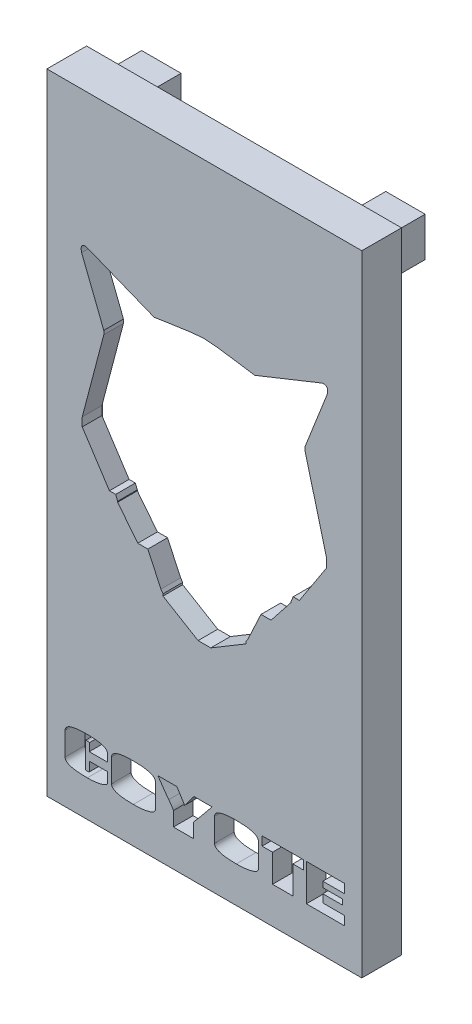
from build123d import *

# Parameters (mm, degrees)
SKETCH1_W               = 50.8
SKETCH1_H               = 89.81384407
SKETCH1_H_2             = 5.893077965
BOSS_EXTRUDE1_DEPTH     = 3.175
CUT_EXTRUDE3_DEPTH      = 114.636616568
CUT_EXTRUDE3_DEPTH_BACK = 114.636616568
SKETCH14_W              = 6.35
SKETCH14_H              = 6.35
BOSS_EXTRUDE2_DEPTH     = 9.5758
CUT_EXTRUDE4_DEPTH      = 115.305655727
SKETCH16_W              = 2.715191334
SKETCH16_H              = 5.015118111
SKETCH16_W_2            = 2.363813632
CUT_EXTRUDE5_DEPTH      = 115.305655727
SKETCH17_W              = 1.689278773
SKETCH17_H              = 0.508
CUT_EXTRUDE6_DEPTH      = 115.305655727
SKETCH18_W              = 2.847153835
SKETCH18_H              = 0.508
SKETCH18_W_2            = 2.886155942
CUT_EXTRUDE10_DEPTH     = 115.305655727
SKETCH20_W              = 0.635
SKETCH20_H              = 0.896075863
SKETCH20_H_2            = 1.286096937
BOSS_EXTRUDE3_DEPTH     = 3.175
SKETCH22_W              = 50.8
SKETCH22_H              = 101.6
SKETCH22_W_2            = 45.72
SKETCH22_H_2            = 96.52
BOSS_EXTRUDE4_DEPTH     = 3.2258


with BuildPart() as part:
    # Sketch1 → Boss-Extrude1 (new body)
    with BuildSketch(Plane.XY):
        with Locations((25.4, 56.693077965)):
            Rectangle(SKETCH1_W, SKETCH1_H)
        with Locations((25.4, 8.839616948)):
            Rectangle(SKETCH1_W, SKETCH1_H_2)
        with Locations((25.4, 2.946538983)):
            Rectangle(SKETCH1_W, SKETCH1_H_2)
    extrude(amount=BOSS_EXTRUDE1_DEPTH)

    # Sketch12 (on Front Plane) → Cut-Extrude3 (cut, two sides: drawn at the far end of the back side and taken through both)
    # profile 1 of 5: a face of its own
    with BuildSketch(Plane.XY.offset(-CUT_EXTRUDE3_DEPTH_BACK)):
        with BuildLine():
            Line((33.533180617, 75.557638808), (44.372260801, 79.896871905))
            add(Edge.make_bspline(
                [(44.372260801, 79.896871905), (45.54754183, 80.104772664), (45.218073682, 78.730973984)],
                knots=[0, 0, 0, 1, 1, 1], degree=2))
            Line((45.218073682, 78.730973984), (41.716677108, 69.854933669))
            Line((41.716677108, 69.854933669), (41.641299392, 69.66385116))
            Line((41.641299392, 69.66385116), (41.641299392, 69.05068653))
            Line((41.641299392, 69.05068653), (45.115249103, 55.842134688))
            Line((45.115249103, 55.842134688), (45.115249103, 54.43891912))
            Line((45.115249103, 54.43891912), (40.729741051, 47.713147015))
            Line((40.729741051, 47.713147015), (39.719862908, 47.713147015))
            Line((39.719862908, 47.713147015), (39.405036562, 46.915062228))
            Line((39.405036562, 46.915062228), (39.405036562, 46.775055961))
            Line((39.405036562, 46.775055961), (36.162162693, 42.66577193))
            Line((36.162162693, 42.66577193), (34.536169198, 42.66577193))
            Line((34.536169198, 42.66577193), (32.418372749, 38.123007656))
            Line((32.418372749, 38.123007656), (32.088635521, 37.637561181))
            Line((32.088635521, 37.637561181), (32.088635521, 37.316983321))
            Line((32.088635521, 37.316983321), (26.432800331, 33.932661708))
            Line((26.432800331, 33.932661708), (24.384837091, 33.932661708))
            Line((24.384837091, 33.932661708), (18.729001901, 37.316983321))
            Line((18.729001901, 37.316983321), (18.729001901, 37.637561181))
            Line((18.729001901, 37.637561181), (18.399264673, 38.123007656))
            Line((18.399264673, 38.123007656), (16.281468224, 42.66577193))
            Line((16.281468224, 42.66577193), (14.655474729, 42.66577193))
            Line((14.655474729, 42.66577193), (11.412600859, 46.775055961))
            Line((11.412600859, 46.775055961), (11.412600859, 46.915062228))
            Line((11.412600859, 46.915062228), (11.097774513, 47.713147015))
            Line((11.097774513, 47.713147015), (10.087896371, 47.713147015))
            Line((10.087896371, 47.713147015), (5.702388318, 54.43891912))
            Line((5.702388318, 54.43891912), (5.702388318, 55.842134688))
            Line((5.702388318, 55.842134688), (9.176338029, 69.05068653))
            Line((9.176338029, 69.05068653), (9.176338029, 69.66385116))
            Line((9.176338029, 69.66385116), (9.100960314, 69.854933669))
            Line((9.100960314, 69.854933669), (5.59956374, 78.730973984))
            add(Edge.make_bspline(
                [(6.445376621, 79.896871905), (5.270095592, 80.104772664), (5.59956374, 78.730973984)],
                knots=[0, 0, 0, 1, 1, 1], degree=2))
            Line((6.445376621, 79.896871905), (17.284456805, 75.557638808))
            add(Edge.make_bspline(
                [(25.408818711, 76.605167447), (22.679673175, 76.517954783), (19.915041946, 75.880309853), (17.284456805, 75.557638808)],
                knots=[0, 0, 0, 0, 1, 1, 1, 1], degree=3))
            add(Edge.make_bspline(
                [(25.408818711, 76.605167447), (28.137964246, 76.517954783), (30.902595475, 75.880309853), (33.533180617, 75.557638808)],
                knots=[0, 0, 0, 0, 1, 1, 1, 1], degree=3))
        make_face()
        with BuildLine():
            Line((28.674531702, 41.349936831), (25.408818711, 42.59901464))
            Line((25.408818711, 42.59901464), (22.14310572, 41.349936831))
            Line((22.14310572, 41.349936831), (21.911080277, 41.066350178))
            Line((21.911080277, 41.066350178), (21.911080277, 40.396054453))
            Line((21.911080277, 40.396054453), (22.513291148, 39.514932902))
            Line((22.513291148, 39.514932902), (22.513291148, 39.068353305))
            Line((22.513291148, 39.068353305), (22.118792937, 39.068353305))
            Line((22.118792937, 39.068353305), (21.911080277, 39.238300027))
            Line((21.911080277, 39.238300027), (21.601713019, 39.238300027))
            Line((21.601713019, 39.238300027), (15.398199281, 52.752570223))
            add(Edge.make_bspline(
                [(15.398199281, 52.752570223), (14.798847293, 53.560396559), (14.590626702, 52.704268037)],
                knots=[0, 0, 0, 1, 1, 1], degree=2))
            Line((14.590626702, 52.704268037), (14.482598203, 51.438992129))
            Line((14.482598203, 51.438992129), (14.034454043, 48.828335407))
            Line((14.034454043, 48.828335407), (14.034454043, 47.713147015))
            add(Edge.make_bspline(
                [(14.034454043, 47.713147015), (14.046644342, 47.46394935), (13.826015308, 47.65023431)],
                knots=[0, 0, 0, 1, 1, 1], degree=2))
            Line((13.826015308, 47.65023431), (13.200935785, 48.507615583))
            Line((13.200935785, 48.507615583), (13.166920012, 48.605047384))
            Line((13.166920012, 48.605047384), (13.099780036, 48.797357255))
            Line((13.099780036, 48.797357255), (11.497674661, 52.493386308))
            Line((11.497674661, 52.493386308), (11.122822158, 53.567081005))
            Line((11.122822158, 53.567081005), (10.9629018, 53.983859421))
            add(Edge.make_bspline(
                [(10.9629018, 53.983859421), (10.734267163, 54.529065093), (10.267019676, 54.55723369), (10.087896371, 53.97682384)],
                knots=[0, 0, 0, 0, 1, 1, 1, 1], degree=3))
            Line((10.087896371, 53.97682384), (9.710568318, 52.872237566))
            Line((9.710568318, 52.872237566), (8.779217587, 54.791682953))
            Line((8.779217587, 54.791682953), (8.700410565, 54.954098434))
            Line((8.700410565, 54.954098434), (8.700410565, 55.307788118))
            Line((8.700410565, 55.307788118), (8.781738852, 55.491219615))
            Line((8.781738852, 55.491219615), (11.877219107, 66.434388967))
            add(Edge.make_bspline(
                [(12.215342826, 66.434388967), (12.017692244, 66.611397939), (11.951050555, 66.685328278), (11.877219107, 66.434388967)],
                knots=[0, 0, 0, 0, 1, 1, 1, 1], degree=3))
            Line((12.215342826, 66.434388967), (13.61010317, 65.261522314))
            add(Edge.make_bspline(
                [(14.271970921, 66.217724851), (14.521104542, 65.45128403), (14.161246687, 65.070199484), (13.61010317, 65.261522314)],
                knots=[0, 0, 0, 0, 1, 1, 1, 1], degree=3))
            Line((14.271970921, 66.217724851), (13.964893083, 67.045129025))
            Line((13.964893083, 67.045129025), (11.282421082, 74.272900807))
            add(Edge.make_bspline(
                [(11.63635836, 74.384670473), (10.943135836, 74.777551714), (10.959759807, 74.700617446), (11.282421082, 74.272900807)],
                knots=[0, 0, 0, 0, 1, 1, 1, 1], degree=3))
            Line((11.63635836, 74.384670473), (16.889532696, 72.465957861))
            add(Edge.make_bspline(
                [(17.988601085, 72.298303361), (17.390511138, 72.248503772), (16.889532696, 72.465957861)],
                knots=[0, 0, 0, 1, 1, 1], degree=2))
            add(Edge.make_bspline(
                [(25.408818711, 73.479704956), (22.679673175, 73.392492293), (20.619186226, 72.620974406), (17.988601085, 72.298303361)],
                knots=[0, 0, 0, 0, 1, 1, 1, 1], degree=3))
            add(Edge.make_bspline(
                [(25.408818711, 73.479704956), (28.137964246, 73.392492293), (30.198451195, 72.620974406), (32.829036337, 72.298303361)],
                knots=[0, 0, 0, 0, 1, 1, 1, 1], degree=3))
            add(Edge.make_bspline(
                [(32.829036337, 72.298303361), (33.427126284, 72.248503772), (33.928104726, 72.465957861)],
                knots=[0, 0, 0, 1, 1, 1], degree=2))
            Line((33.928104726, 72.465957861), (39.181279062, 74.384670473))
            add(Edge.make_bspline(
                [(39.181279062, 74.384670473), (39.874501586, 74.777551714), (39.857877615, 74.700617446), (39.53521634, 74.272900807)],
                knots=[0, 0, 0, 0, 1, 1, 1, 1], degree=3))
            Line((39.53521634, 74.272900807), (36.852744339, 67.045129025))
            Line((36.852744339, 67.045129025), (36.5456665, 66.217724851))
            add(Edge.make_bspline(
                [(36.5456665, 66.217724851), (36.29653288, 65.45128403), (36.656390734, 65.070199484), (37.207534252, 65.261522314)],
                knots=[0, 0, 0, 0, 1, 1, 1, 1], degree=3))
            Line((37.207534252, 65.261522314), (38.602294596, 66.434388967))
            add(Edge.make_bspline(
                [(38.602294596, 66.434388967), (38.799945178, 66.611397939), (38.866586866, 66.685328278), (38.940418315, 66.434388967)],
                knots=[0, 0, 0, 0, 1, 1, 1, 1], degree=3))
            Line((38.940418315, 66.434388967), (42.035898569, 55.491219615))
            Line((42.035898569, 55.491219615), (42.117226857, 55.307788118))
            Line((42.117226857, 55.307788118), (42.117226857, 54.954098434))
            Line((42.117226857, 54.954098434), (42.038419834, 54.791682953))
            Line((42.038419834, 54.791682953), (41.107069104, 52.872237566))
            Line((41.107069104, 52.872237566), (40.729741051, 53.97682384))
            add(Edge.make_bspline(
                [(39.854735622, 53.983859421), (40.083370258, 54.529065093), (40.550617746, 54.55723369), (40.729741051, 53.97682384)],
                knots=[0, 0, 0, 0, 1, 1, 1, 1], degree=3))
            Line((39.854735622, 53.983859421), (39.694815264, 53.567081005))
            Line((39.694815264, 53.567081005), (39.319962761, 52.493386308))
            Line((39.319962761, 52.493386308), (37.717857386, 48.797357255))
            Line((37.717857386, 48.797357255), (37.65071741, 48.605047384))
            Line((37.65071741, 48.605047384), (37.616701637, 48.507615583))
            Line((37.616701637, 48.507615583), (36.991622114, 47.65023431))
            add(Edge.make_bspline(
                [(36.783183379, 47.713147015), (36.77099308, 47.46394935), (36.991622114, 47.65023431)],
                knots=[0, 0, 0, 1, 1, 1], degree=2))
            Line((36.783183379, 47.713147015), (36.783183379, 48.828335407))
            Line((36.783183379, 48.828335407), (36.335039219, 51.438992129))
            Line((36.335039219, 51.438992129), (36.22701072, 52.704268037))
            add(Edge.make_bspline(
                [(35.419438141, 52.752570223), (36.018790129, 53.560396559), (36.22701072, 52.704268037)],
                knots=[0, 0, 0, 1, 1, 1], degree=2))
            Line((35.419438141, 52.752570223), (29.215924403, 39.238300027))
            Line((29.215924403, 39.238300027), (28.906557145, 39.238300027))
            Line((28.906557145, 39.238300027), (28.698844485, 39.068353305))
            Line((28.698844485, 39.068353305), (28.304346274, 39.068353305))
            Line((28.304346274, 39.068353305), (28.304346274, 39.514932902))
            Line((28.304346274, 39.514932902), (28.906557145, 40.396054453))
            Line((28.906557145, 40.396054453), (28.906557145, 41.066350178))
            Line((28.906557145, 41.066350178), (28.674531702, 41.349936831))
        make_face(mode=Mode.SUBTRACT)
    # profile 2 of 5: a face of its own
    with BuildSketch(Plane.XY.offset(-CUT_EXTRUDE3_DEPTH_BACK)):
        Polygon((35.090733315, 71.786953389), (36.162162693, 71.395679368), (36.162162693, 68.348736992), (38.345800171, 73.193874869), align=None)
    # profile 3 of 5: a face of its own
    with BuildSketch(Plane.XY.offset(-CUT_EXTRUDE3_DEPTH_BACK)):
        with BuildLine():
            Line((28.176504492, 56.167727254), (30.163245017, 57.002492181))
            Line((30.163245017, 57.002492181), (32.684235094, 57.820561808))
            Line((32.684235094, 57.820561808), (36.162162693, 59.623654049))
            Line((36.162162693, 59.623654049), (36.162162693, 59.762531825))
            Line((36.162162693, 59.762531825), (36.852744339, 59.762531825))
            Line((36.852744339, 59.762531825), (36.991622114, 59.623654049))
            Line((36.991622114, 59.623654049), (36.991622114, 58.672022033))
            Line((36.991622114, 58.672022033), (34.536169198, 55.307788118))
            Line((34.536169198, 55.307788118), (34.390772983, 55.162391904))
            Line((34.390772983, 55.162391904), (34.390772983, 54.954098434))
            Line((34.390772983, 54.954098434), (34.229580867, 54.792906318))
            Line((34.229580867, 54.792906318), (34.11047307, 54.629715858))
            Line((34.11047307, 54.629715858), (30.163245017, 54.629715858))
            Line((30.163245017, 54.629715858), (29.898904076, 54.629715858))
            Line((29.898904076, 54.629715858), (29.867317141, 54.43891912))
            Line((29.867317141, 54.43891912), (29.766154722, 53.469833555))
            Line((29.766154722, 53.469833555), (29.602957412, 52.432038183))
            Line((29.602957412, 52.432038183), (29.441680374, 51.378361538))
            Line((29.441680374, 51.378361538), (29.215924403, 50.387741624))
            Line((29.215924403, 50.387741624), (29.098173598, 49.353222475))
            Line((29.098173598, 49.353222475), (28.906557145, 48.462636424))
            Line((28.906557145, 48.462636424), (28.819303219, 47.814937479))
            add(Edge.make_bspline(
                [(28.176504492, 47.713147015), (28.169003086, 47.319111494), (28.675401316, 47.084869755), (28.819303219, 47.814937479)],
                knots=[0, 0, 0, 0, 1, 1, 1, 1], degree=3))
            Line((28.176504492, 47.713147015), (28.176504492, 56.167727254))
        make_face()
    # profile 4 of 5: a face of its own
    with BuildSketch(Plane.XY.offset(-CUT_EXTRUDE3_DEPTH_BACK)):
        with BuildLine():
            Line((22.64113293, 56.167727254), (22.64113293, 47.713147015))
            add(Edge.make_bspline(
                [(22.64113293, 47.713147015), (22.648634336, 47.319111494), (22.142236106, 47.084869755), (21.998334203, 47.814937479)],
                knots=[0, 0, 0, 0, 1, 1, 1, 1], degree=3))
            Line((21.998334203, 47.814937479), (21.911080277, 48.462636424))
            Line((21.911080277, 48.462636424), (21.719463824, 49.353222475))
            Line((21.719463824, 49.353222475), (21.601713019, 50.387741624))
            Line((21.601713019, 50.387741624), (21.375957048, 51.378361538))
            Line((21.375957048, 51.378361538), (21.21468001, 52.432038183))
            Line((21.21468001, 52.432038183), (21.0514827, 53.469833555))
            Line((21.0514827, 53.469833555), (20.950320281, 54.43891912))
            Line((20.950320281, 54.43891912), (20.918733345, 54.629715858))
            Line((20.918733345, 54.629715858), (20.654392405, 54.629715858))
            Line((20.654392405, 54.629715858), (16.707164352, 54.629715858))
            Line((16.707164352, 54.629715858), (16.588056555, 54.792906318))
            Line((16.588056555, 54.792906318), (16.426864439, 54.954098434))
            Line((16.426864439, 54.954098434), (16.426864439, 55.162391904))
            Line((16.426864439, 55.162391904), (16.281468224, 55.307788118))
            Line((16.281468224, 55.307788118), (13.826015308, 58.672022033))
            Line((13.826015308, 58.672022033), (13.826015308, 59.623654049))
            Line((13.826015308, 59.623654049), (13.964893083, 59.762531825))
            Line((13.964893083, 59.762531825), (14.655474729, 59.762531825))
            Line((14.655474729, 59.762531825), (14.655474729, 59.623654049))
            Line((14.655474729, 59.623654049), (18.133402328, 57.820561808))
            Line((18.133402328, 57.820561808), (20.654392405, 57.002492181))
            Line((20.654392405, 57.002492181), (22.64113293, 56.167727254))
        make_face()
    # profile 5 of 5: a face of its own
    with BuildSketch(Plane.XY.offset(-CUT_EXTRUDE3_DEPTH_BACK)):
        Polygon((14.655474729, 68.348736992), (12.471837251, 73.193874869), (15.726904106, 71.786953389), (14.655474729, 71.395679368), align=None)
    extrude(amount=CUT_EXTRUDE3_DEPTH + CUT_EXTRUDE3_DEPTH_BACK, mode=Mode.SUBTRACT)


with BuildPart() as cut_extrude3_kept_piece:
    # of the separate pieces the step leaves, the one the design keeps (cut_extrude3_pieces_kept)
    add(part.part.solids().sort_by_distance((50.8, 101.6, 0))[0])

    # Sketch14 → Boss-Extrude2 (add)
    with BuildSketch(Plane(origin=(0, 0, 0), x_dir=(-1, 0, 0), z_dir=(0, 0, -1))):
        with Locations((-45.085, 95.885)):
            Rectangle(SKETCH14_W, SKETCH14_H)
        with Locations((-5.715, 95.885)):
            Rectangle(SKETCH14_W, SKETCH14_H)
    extrude(amount=BOSS_EXTRUDE2_DEPTH)

    # Sketch15 → Cut-Extrude4 (cut, through all)
    # profile 1 of 6: a face of its own
    with BuildSketch(Plane.XY.offset(3.175)):
        with BuildLine():
            Line((9.799157072, 9.637280268), (6.834996916, 9.637280268))
            Line((6.834996916, 9.637280268), (6.834996916, 10.896317045))
            add(Edge.make_bspline(
                [(6.834996916, 10.896317045), (6.833946993, 10.901948409), (6.831582538, 10.914630385), (6.811697515, 10.927795913), (6.785109056, 10.940015062), (6.746507723, 10.947002557), (6.698709293, 10.954476028), (6.640127776, 10.960884763), (6.570520738, 10.962267162), (6.520540775, 10.962973171), (6.493728477, 10.963351917)],
                knots=[0, 0, 0, 0, 0.365952302, 0.824133875, 1.474330997, 2.329396344, 3.391050161, 4.689494579, 6.224043192, 8, 8, 8, 8], degree=3))
            add(Edge.make_bspline(
                [(6.493728477, 10.963351917), (6.471799777, 10.96294156), (6.430770988, 10.962173779), (6.373228416, 10.961159728), (6.324749965, 10.953545723), (6.284213388, 10.9494773), (6.253283568, 10.939060348), (6.230414366, 10.928871883), (6.214464697, 10.91497693), (6.212077004, 10.903083759), (6.210963199, 10.897535861)],
                knots=[0, 0, 0, 0, 1.726425098, 3.230156376, 4.518721014, 5.5856171, 6.424669603, 7.067959955, 7.565224172, 8, 8, 8, 8], degree=3))
            Line((6.210963199, 10.897535861), (6.210963199, 6.816940382))
            add(Edge.make_bspline(
                [(6.210963199, 6.816940382), (6.212075907, 6.811388554), (6.214461247, 6.799486957), (6.230432516, 6.785669349), (6.253075882, 6.775099387), (6.284611996, 6.767056193), (6.324533945, 6.760198559), (6.373279299, 6.753568304), (6.430755115, 6.752223915), (6.471794248, 6.751507324), (6.493728477, 6.751124326)],
                knots=[0, 0, 0, 0, 0.434989469, 0.932498034, 1.576104487, 2.406381142, 3.479058565, 4.768256382, 6.272726567, 8, 8, 8, 8], degree=3))
            add(Edge.make_bspline(
                [(6.493728477, 6.751124326), (6.520545811, 6.751445394), (6.570535164, 6.752043887), (6.640044283, 6.754112543), (6.698765263, 6.758485283), (6.746540894, 6.766187572), (6.784845163, 6.773559705), (6.811432627, 6.784363831), (6.831407377, 6.796049581), (6.833908065, 6.808056065), (6.834996916, 6.813283935)],
                knots=[0, 0, 0, 0, 1.788408636, 3.333716483, 4.638735892, 5.70783332, 6.568893816, 7.212910625, 7.657285113, 8, 8, 8, 8], degree=3))
            Line((6.834996916, 6.813283935), (6.834996916, 8.311208619))
            Line((6.834996916, 8.311208619), (9.799157072, 8.311208619))
            Line((9.799157072, 8.311208619), (9.799157072, 6.786469986))
            add(Edge.make_bspline(
                [(9.799157072, 6.786469986), (9.796091841, 6.749373847), (9.789874209, 6.674126619), (9.737280582, 6.566535551), (9.654555017, 6.466953517), (9.538663148, 6.375835588), (9.393793727, 6.289347725), (9.216162551, 6.211671071), (9.008181421, 6.137226579), (8.771481856, 6.071546148), (8.515947035, 6.011878444), (8.249561925, 5.959678343), (7.976908037, 5.914421561), (7.697231631, 5.877816362), (7.410595975, 5.850261423), (7.116798251, 5.829304204), (6.816011207, 5.816896301), (6.61318383, 5.815685162), (6.510791899, 5.815073751)],
                knots=[0, 0, 0, 0, 0.490759217, 0.995474791, 1.559363794, 2.199956595, 2.943178315, 3.795832561, 4.770576638, 5.87588147, 7.0566619, 8.255848392, 9.4811281, 10.727571453, 12.001895812, 13.305773387, 14.639892352, 16, 16, 16, 16], degree=3))
            add(Edge.make_bspline(
                [(6.510791899, 5.815073751), (6.366558048, 5.816182353), (6.086976381, 5.818331259), (5.681764914, 5.829887093), (5.304120576, 5.851321646), (4.955080136, 5.883362385), (4.633248686, 5.921157654), (4.339664274, 5.969841472), (4.073764318, 6.026147792), (3.835989577, 6.091930169), (3.625427339, 6.165054031), (3.442702152, 6.2487965), (3.287328511, 6.34148989), (3.158578849, 6.441995791), (3.05832611, 6.553146659), (2.987189362, 6.674075789), (2.941603318, 6.804411537), (2.937071145, 6.895390992), (2.934786184, 6.941259599)],
                knots=[0, 0, 0, 0, 1.719998077, 3.334029593, 4.833597471, 6.22973688, 7.513305063, 8.69686454, 9.777288906, 10.752903258, 11.637054905, 12.432569393, 13.145456977, 13.790101069, 14.373487122, 14.918560018, 15.45477641, 16, 16, 16, 16], degree=3))
            Line((2.934786184, 6.941259599), (2.934786184, 10.68911835))
            add(Edge.make_bspline(
                [(2.934786184, 10.68911835), (2.937082629, 10.738206296), (2.941633461, 10.835483201), (2.986751192, 10.975158856), (3.057932886, 11.104974342), (3.158048689, 11.224696788), (3.286118362, 11.334166112), (3.442411387, 11.432760502), (3.625051755, 11.522770231), (3.835538618, 11.602204232), (4.073438793, 11.672856008), (4.339566937, 11.732545855), (4.633156703, 11.784793935), (4.954867304, 11.826990177), (5.304119785, 11.85943167), (5.681766773, 11.881787643), (6.086927436, 11.896920996), (6.36655052, 11.898558037), (6.510791899, 11.899402492)],
                knots=[0, 0, 0, 0, 0.576672369, 1.142783657, 1.710329241, 2.312033492, 2.970214782, 3.687039998, 4.483181726, 5.364812617, 6.333810456, 7.404146345, 8.575675279, 9.845368211, 11.224882381, 12.7064068, 14.301025736, 16, 16, 16, 16], degree=3))
            add(Edge.make_bspline(
                [(6.510791899, 11.899402492), (6.643649316, 11.898289173), (6.900483041, 11.896136958), (7.273226361, 11.884683258), (7.619896351, 11.862627297), (7.941615512, 11.833139285), (8.237024208, 11.792496057), (8.507539077, 11.746490757), (8.751741435, 11.688476699), (8.971578774, 11.625615074), (9.165657063, 11.551601062), (9.333224609, 11.46744956), (9.476587898, 11.37692497), (9.593700307, 11.27573074), (9.685593692, 11.165295906), (9.752000028, 11.045257896), (9.791154693, 10.915364267), (9.796465305, 10.825884013), (9.799157072, 10.780529539)],
                knots=[0, 0, 0, 0, 1.700248305, 3.286840272, 4.771549569, 6.145089067, 7.420078538, 8.586844075, 9.654999965, 10.630571125, 11.511132305, 12.308655039, 13.026833993, 13.675374198, 14.28115851, 14.855846563, 15.420067822, 16, 16, 16, 16], degree=3))
            Line((9.799157072, 10.780529539), (9.799157072, 9.637280268))
        make_face()
    # profile 2 of 6: a face of its own
    with BuildSketch(Plane.XY.offset(3.175)):
        with BuildLine():
            Line((10.423190789, 6.941259599), (10.423190789, 10.68911835))
            add(Edge.make_bspline(
                [(10.423190789, 10.68911835), (10.425617779, 10.738164793), (10.430421428, 10.835240604), (10.47354526, 10.975416669), (10.545271148, 11.104602173), (10.643787204, 11.224304413), (10.769643475, 11.334589869), (10.924491306, 11.432385838), (11.104818586, 11.522848895), (11.313280224, 11.602461301), (11.548923747, 11.672474839), (11.812082873, 11.732647593), (12.102049983, 11.784799179), (12.419704969, 11.826925735), (12.764885878, 11.859516012), (13.138076034, 11.881744053), (13.538765399, 11.896934032), (13.815140065, 11.898562275), (13.957756765, 11.899402492)],
                knots=[0, 0, 0, 0, 0.582193676, 1.152314393, 1.725293899, 2.329696594, 2.986903367, 3.706532481, 4.501654244, 5.382711692, 6.356359199, 7.422820608, 8.5913003, 9.858783848, 11.23226679, 12.713509471, 14.304083224, 16, 16, 16, 16], degree=3))
            add(Edge.make_bspline(
                [(13.957756765, 11.899402492), (14.101584887, 11.898375488), (14.379962018, 11.896387735), (14.7840106, 11.883742833), (15.159939839, 11.859235975), (15.508271497, 11.826442491), (15.8290158, 11.786504403), (16.121664749, 11.733685232), (16.38696888, 11.673987988), (16.623901965, 11.603357299), (16.834231865, 11.5250976), (17.016293427, 11.43563048), (17.17065985, 11.336382978), (17.299115407, 11.229252256), (17.398417554, 11.109786224), (17.469049968, 10.98067782), (17.515058226, 10.842100419), (17.519377276, 10.745546823), (17.521574322, 10.696431245)],
                knots=[0, 0, 0, 0, 1.700880252, 3.292027728, 4.779706038, 6.155102274, 7.42918499, 8.600611453, 9.67049234, 10.643317249, 11.522227757, 12.321513858, 13.037133509, 13.688006554, 14.292087244, 14.861874357, 15.421050056, 16, 16, 16, 16], degree=3))
            Line((17.521574322, 10.696431245), (17.521574322, 6.948572495))
            add(Edge.make_bspline(
                [(17.521574322, 6.948572495), (17.518576535, 6.903843636), (17.512571026, 6.814237687), (17.461281446, 6.685260233), (17.380353786, 6.565609175), (17.266761967, 6.45559002), (17.121989595, 6.355133069), (16.946624351, 6.261987561), (16.739997686, 6.176801371), (16.504194706, 6.102387338), (16.244467685, 6.034929289), (15.96591916, 5.975475541), (15.669885, 5.925494751), (15.356704324, 5.885980368), (15.026242823, 5.854471356), (14.678760143, 5.831259259), (14.314160436, 5.81807226), (14.065429292, 5.816088186), (13.938255712, 5.815073751)],
                knots=[0, 0, 0, 0, 0.534483477, 1.070738238, 1.639266954, 2.255557592, 2.954018882, 3.744809836, 4.630969847, 5.628748901, 6.705802321, 7.846045289, 9.041137084, 10.302746612, 11.628307486, 13.019055925, 14.475875098, 16, 16, 16, 16], degree=3))
            add(Edge.make_bspline(
                [(13.938255712, 5.815073751), (13.7964592, 5.816178993), (13.521751259, 5.818320223), (13.123445951, 5.829915401), (12.752293105, 5.851284917), (12.408952095, 5.883439183), (12.092770794, 5.921012859), (11.804482505, 5.969880247), (11.543133038, 6.0264826), (11.308849228, 6.091671661), (11.101526226, 6.164974266), (10.922250438, 6.249092738), (10.769450553, 6.341394267), (10.643154513, 6.442405359), (10.544200187, 6.553170297), (10.474235817, 6.674178025), (10.430303296, 6.804623278), (10.425576971, 6.895419346), (10.423190789, 6.941259599)],
                knots=[0, 0, 0, 0, 1.715337563, 3.323190717, 4.819871539, 6.211690768, 7.494272785, 8.670680327, 9.747489843, 10.72771995, 11.610750776, 12.404392445, 13.119170757, 13.765465791, 14.354018504, 14.904485114, 15.446906894, 16, 16, 16, 16], degree=3))
        make_face()
        with BuildLine():
            Line((14.323401521, 6.84984841), (14.323401521, 10.864627833))
            add(Edge.make_bspline(
                [(14.323401521, 10.864627833), (14.322156325, 10.872733563), (14.319521123, 10.889887677), (14.297503258, 10.909840294), (14.267297939, 10.92679796), (14.225071332, 10.94098734), (14.171054375, 10.951424618), (14.104948677, 10.957975258), (14.027311084, 10.963157299), (13.971581659, 10.963284302), (13.941912159, 10.963351917)],
                knots=[0, 0, 0, 0, 0.459853115, 0.973184737, 1.623515249, 2.467427237, 3.51861048, 4.79030751, 6.291208462, 8, 8, 8, 8], degree=3))
            add(Edge.make_bspline(
                [(13.941912159, 10.963351917), (13.916709875, 10.963299388), (13.869905244, 10.963201834), (13.804842794, 10.957962656), (13.749701558, 10.95135073), (13.704061579, 10.940899924), (13.668263641, 10.926316299), (13.641586966, 10.910023563), (13.624135302, 10.888822284), (13.62227833, 10.872612662), (13.62136359, 10.864627833)],
                knots=[0, 0, 0, 0, 1.683423799, 3.126384544, 4.358877047, 5.392659822, 6.244706536, 6.929902832, 7.472872146, 8, 8, 8, 8], degree=3))
            Line((13.62136359, 10.864627833), (13.62136359, 6.84984841))
            add(Edge.make_bspline(
                [(13.62136359, 6.84984841), (13.62227833, 6.841863581), (13.624135302, 6.825653959), (13.641586966, 6.80445268), (13.668263641, 6.788159943), (13.704061579, 6.773576319), (13.749701558, 6.763125513), (13.804842794, 6.756513587), (13.869905244, 6.751274409), (13.916709875, 6.751176855), (13.941912159, 6.751124326)],
                knots=[0, 0, 0, 0, 0.527127854, 1.070097168, 1.755293464, 2.607340178, 3.641122953, 4.873615456, 6.316576201, 8, 8, 8, 8], degree=3))
            add(Edge.make_bspline(
                [(13.941912159, 6.751124326), (13.971581659, 6.751191941), (14.027311084, 6.751318944), (14.104948677, 6.756500985), (14.171054375, 6.763051625), (14.225071332, 6.773488903), (14.267297939, 6.787678283), (14.297503258, 6.804635949), (14.319521123, 6.824588566), (14.322156325, 6.84174268), (14.323401521, 6.84984841)],
                knots=[0, 0, 0, 0, 1.708791538, 3.20969249, 4.48138952, 5.532572763, 6.376484751, 7.026815263, 7.540146885, 8, 8, 8, 8], degree=3))
        make_face(mode=Mode.SUBTRACT)
    # profile 3 of 6: a face of its own
    with BuildSketch(Plane.XY.offset(3.175)):
        with BuildLine():
            Line((26.648067434, 11.821398278), (24.633364828, 9.365484332))
            Line((24.633364828, 9.365484332), (23.683907278, 8.247830195))
            Line((23.683907278, 8.247830195), (23.683907278, 5.893077965))
            Line((23.683907278, 5.893077965), (20.407730263, 5.893077965))
            Line((20.407730263, 5.893077965), (20.407730263, 8.195421113))
            add(Edge.make_bspline(
                [(20.407730263, 8.195421113), (20.398519472, 8.222455465), (20.377517838, 8.28409681), (20.327861504, 8.382336484), (20.26161174, 8.499845765), (20.176227592, 8.635442373), (20.071646721, 8.789227122), (19.949922134, 8.962046498), (19.809682405, 9.153702977), (19.708010214, 9.286071014), (19.654502066, 9.355733806)],
                knots=[0, 0, 0, 0, 0.493333368, 1.124855216, 1.898595409, 2.826390341, 3.894078305, 5.114116488, 6.481214162, 8, 8, 8, 8], degree=3))
            add(Edge.make_bspline(
                [(19.654502066, 9.355733806), (19.62970486, 9.387817749), (19.578322928, 9.454298427), (19.499009329, 9.557526275), (19.416064164, 9.669408936), (19.327221123, 9.787941118), (19.234327057, 9.915218456), (19.13771724, 10.050339225), (19.0339088, 10.191631272), (18.929378663, 10.34290688), (18.817501095, 10.500265059), (18.701776087, 10.666073055), (18.582002237, 10.840166313), (18.455025554, 11.020499487), (18.327343525, 11.210733199), (18.192249724, 11.407075931), (18.053829798, 11.61178885), (17.959555181, 11.750720418), (17.911595395, 11.821398278)],
                knots=[0, 0, 0, 0, 0.644504284, 1.335468065, 2.069021143, 2.858110294, 3.689877721, 4.573399097, 5.498217671, 6.476347651, 7.49574614, 8.566980871, 9.690072601, 10.854415936, 12.072302057, 13.331413896, 14.642425492, 16, 16, 16, 16], degree=3))
            Line((17.911595395, 11.821398278), (20.976917267, 11.821398278))
            Line((20.976917267, 11.821398278), (22.223765885, 9.831071989))
            Line((22.223765885, 9.831071989), (23.733878728, 11.821398278))
            Line((23.733878728, 11.821398278), (26.648067434, 11.821398278))
        make_face()
    # profile 4 of 6: a face of its own
    with BuildSketch(Plane.XY.offset(3.175)):
        with BuildLine():
            Line((27.038088507, 6.941259599), (27.038088507, 10.68911835))
            add(Edge.make_bspline(
                [(27.038088507, 10.68911835), (27.040515496, 10.738164793), (27.045319146, 10.835240604), (27.088442978, 10.975416669), (27.160168866, 11.104602173), (27.258684922, 11.224304413), (27.384541193, 11.334589869), (27.539389024, 11.432385838), (27.719716304, 11.522848895), (27.928177942, 11.602461301), (28.163821465, 11.672474839), (28.426980591, 11.732647593), (28.716947701, 11.784799179), (29.034602687, 11.826925735), (29.379783596, 11.859516012), (29.752973752, 11.881744053), (30.153663117, 11.896934032), (30.430037783, 11.898562275), (30.572654483, 11.899402492)],
                knots=[0, 0, 0, 0, 0.582193676, 1.152314393, 1.725293899, 2.329696594, 2.986903367, 3.706532481, 4.501654244, 5.382711692, 6.356359199, 7.422820608, 8.5913003, 9.858783848, 11.23226679, 12.713509471, 14.304083224, 16, 16, 16, 16], degree=3))
            add(Edge.make_bspline(
                [(30.572654483, 11.899402492), (30.716482605, 11.898375488), (30.994859736, 11.896387735), (31.398908318, 11.883742833), (31.774837557, 11.859235975), (32.123169215, 11.826442491), (32.443913518, 11.786504403), (32.736562467, 11.733685232), (33.001866598, 11.673987988), (33.238799683, 11.603357299), (33.449129583, 11.5250976), (33.631191145, 11.43563048), (33.785557568, 11.336382978), (33.914013125, 11.229252256), (34.013315272, 11.109786224), (34.083947686, 10.98067782), (34.129955944, 10.842100419), (34.134274994, 10.745546823), (34.136472039, 10.696431245)],
                knots=[0, 0, 0, 0, 1.700880252, 3.292027728, 4.779706038, 6.155102274, 7.42918499, 8.600611453, 9.67049234, 10.643317249, 11.522227757, 12.321513858, 13.037133509, 13.688006554, 14.292087244, 14.861874357, 15.421050056, 16, 16, 16, 16], degree=3))
            Line((34.136472039, 10.696431245), (34.136472039, 6.948572495))
            add(Edge.make_bspline(
                [(34.136472039, 6.948572495), (34.133474253, 6.903843636), (34.127468744, 6.814237687), (34.076179164, 6.685260233), (33.995251504, 6.565609175), (33.881659685, 6.45559002), (33.736887313, 6.355133069), (33.561522069, 6.261987561), (33.354895404, 6.176801371), (33.119092424, 6.102387338), (32.859365403, 6.034929289), (32.580816878, 5.975475541), (32.284782718, 5.925494751), (31.971602041, 5.885980368), (31.641140541, 5.854471356), (31.293657861, 5.831259259), (30.929058154, 5.81807226), (30.68032701, 5.816088186), (30.55315343, 5.815073751)],
                knots=[0, 0, 0, 0, 0.534483477, 1.070738238, 1.639266954, 2.255557592, 2.954018882, 3.744809836, 4.630969847, 5.628748901, 6.705802321, 7.846045289, 9.041137084, 10.302746612, 11.628307486, 13.019055925, 14.475875098, 16, 16, 16, 16], degree=3))
            add(Edge.make_bspline(
                [(30.55315343, 5.815073751), (30.411356918, 5.816178993), (30.136648977, 5.818320223), (29.738343669, 5.829915401), (29.367190822, 5.851284917), (29.023849813, 5.883439183), (28.707668512, 5.921012859), (28.419380223, 5.969880247), (28.158030756, 6.0264826), (27.923746946, 6.091671661), (27.716423944, 6.164974266), (27.537148156, 6.249092738), (27.384348271, 6.341394267), (27.258052231, 6.442405359), (27.159097905, 6.553170297), (27.089133535, 6.674178025), (27.045201014, 6.804623278), (27.040474689, 6.895419346), (27.038088507, 6.941259599)],
                knots=[0, 0, 0, 0, 1.715337563, 3.323190717, 4.819871539, 6.211690768, 7.494272785, 8.670680327, 9.747489843, 10.72771995, 11.610750776, 12.404392445, 13.119170757, 13.765465791, 14.354018504, 14.904485114, 15.446906894, 16, 16, 16, 16], degree=3))
        make_face()
        with BuildLine():
            Line((30.938299239, 6.84984841), (30.938299239, 10.864627833))
            add(Edge.make_bspline(
                [(30.938299239, 10.864627833), (30.937054043, 10.872733563), (30.934418841, 10.889887677), (30.912400976, 10.909840294), (30.882195657, 10.92679796), (30.83996905, 10.94098734), (30.785952093, 10.951424618), (30.719846395, 10.957975258), (30.642208802, 10.963157299), (30.586479377, 10.963284302), (30.556809877, 10.963351917)],
                knots=[0, 0, 0, 0, 0.459853115, 0.973184737, 1.623515249, 2.467427237, 3.51861048, 4.79030751, 6.291208462, 8, 8, 8, 8], degree=3))
            add(Edge.make_bspline(
                [(30.556809877, 10.963351917), (30.531607593, 10.963299388), (30.484802962, 10.963201834), (30.419740511, 10.957962656), (30.364599276, 10.95135073), (30.318959297, 10.940899924), (30.283161359, 10.926316299), (30.256484684, 10.910023563), (30.23903302, 10.888822284), (30.237176048, 10.872612662), (30.236261308, 10.864627833)],
                knots=[0, 0, 0, 0, 1.683423799, 3.126384544, 4.358877047, 5.392659822, 6.244706536, 6.929902832, 7.472872146, 8, 8, 8, 8], degree=3))
            Line((30.236261308, 10.864627833), (30.236261308, 6.84984841))
            add(Edge.make_bspline(
                [(30.236261308, 6.84984841), (30.237176048, 6.841863581), (30.23903302, 6.825653959), (30.256484684, 6.80445268), (30.283161359, 6.788159943), (30.318959297, 6.773576319), (30.364599276, 6.763125513), (30.419740511, 6.756513587), (30.484802962, 6.751274409), (30.531607593, 6.751176855), (30.556809877, 6.751124326)],
                knots=[0, 0, 0, 0, 0.527127854, 1.070097168, 1.755293464, 2.607340178, 3.641122953, 4.873615456, 6.316576201, 8, 8, 8, 8], degree=3))
            add(Edge.make_bspline(
                [(30.556809877, 6.751124326), (30.586479377, 6.751191941), (30.642208802, 6.751318944), (30.719846395, 6.756500985), (30.785952093, 6.763051625), (30.83996905, 6.773488903), (30.882195657, 6.787678283), (30.912400976, 6.804635949), (30.934418841, 6.824588566), (30.937054043, 6.84174268), (30.938299239, 6.84984841)],
                knots=[0, 0, 0, 0, 1.708791538, 3.20969249, 4.48138952, 5.532572763, 6.376484751, 7.026815263, 7.540146885, 8, 8, 8, 8], degree=3))
        make_face(mode=Mode.SUBTRACT)
    # profile 5 of 6: a face of its own
    with BuildSketch(Plane.XY.offset(3.175)):
        Polygon((41.364050052, 10.885347702), (39.674771279, 10.885347702), (39.674771279, 5.893077965), (36.398594264, 5.893077965), (36.398594264, 10.885347702), (34.709315491, 10.885347702), (34.709315491, 11.821398278), (41.364050052, 11.821398278), align=None)
    # profile 6 of 6: a face of its own
    with BuildSketch(Plane.XY.offset(3.175)):
        Polygon((48.021222245, 5.893077965), (41.858889289, 5.893077965), (41.858889289, 11.821398278), (47.982220138, 11.821398278), (47.982220138, 10.885347702), (45.135066303, 10.885347702), (45.135066303, 9.481271839), (47.703111307, 9.481271839), (47.703111307, 8.623225478), (45.135066303, 8.623225478), (45.135066303, 6.829128541), (48.021222245, 6.829128541), align=None)
    extrude(amount=-CUT_EXTRUDE4_DEPTH, mode=Mode.SUBTRACT)


with BuildPart() as cut_extrude4_piece_1:
    # of the separate pieces the step leaves, piece 1, a body of its own (cut_extrude4_pieces)
    add(cut_extrude3_kept_piece.part.solids().sort_by_distance((50.8, 101.6, 0))[0])

    # Sketch17 → Cut-Extrude6 (cut, through all)
    with BuildSketch(Plane.XY.offset(3.175)):
        with Locations((35.553954878, 10.631347702)):
            Rectangle(SKETCH17_W, SKETCH17_H)
        with Locations((40.519410666, 10.631347702)):
            Rectangle(SKETCH17_W, SKETCH17_H)
    extrude(amount=-CUT_EXTRUDE6_DEPTH, mode=Mode.SUBTRACT)

    # Sketch18 → Cut-Extrude10 (cut, through all)
    with BuildSketch(Plane.XY.offset(3.175)):
        with Locations((46.558643221, 10.631347702)):
            Rectangle(SKETCH18_W, SKETCH18_H)
        with Locations((46.578144274, 7.083128541)):
            Rectangle(SKETCH18_W_2, SKETCH18_H)
    extrude(amount=-CUT_EXTRUDE10_DEPTH, mode=Mode.SUBTRACT)

    # Sketch20 → Boss-Extrude3 (add)
    with BuildSketch(Plane.XY.offset(3.175)):
        with Locations((44.817566303, 9.929309771)):
            Rectangle(SKETCH20_W, SKETCH20_H)
        with Locations((44.817566303, 7.98017701)):
            Rectangle(SKETCH20_W, SKETCH20_H_2)
    extrude(amount=-BOSS_EXTRUDE3_DEPTH)

    # Sketch22 → Boss-Extrude4 (add)
    with BuildSketch(Plane(origin=(0, 0, 0), x_dir=(-1, 0, 0), z_dir=(0, 0, -1))):
        with Locations((-25.4, 50.8)):
            Rectangle(SKETCH22_W, SKETCH22_H)
        with Locations((-25.4, 50.8)):
            Rectangle(SKETCH22_W_2, SKETCH22_H_2, mode=Mode.SUBTRACT)
    extrude(amount=BOSS_EXTRUDE4_DEPTH)


with BuildPart() as cut_extrude4_piece_2:
    # of the separate pieces the step leaves, piece 2, a body of its own (cut_extrude4_pieces)
    add(cut_extrude3_kept_piece.part.solids().sort_by_distance((14.323401521, 6.84984841, 0))[0])


with BuildPart() as cut_extrude4_piece_3:
    # of the separate pieces the step leaves, piece 3, a body of its own (cut_extrude4_pieces)
    add(cut_extrude3_kept_piece.part.solids().sort_by_distance((30.938299239, 6.84984841, 0))[0])


with BuildPart() as cut_extrude5_tool:
    # Sketch16 → Cut-Extrude5 (new, through all)
    with BuildSketch(Plane.XY.offset(3.175)):
        with Locations((13.802972852, 8.943533765)):
            Rectangle(SKETCH16_W, SKETCH16_H)
        with Locations((30.653130834, 8.943533765)):
            Rectangle(SKETCH16_W_2, SKETCH16_H)
    extrude(amount=-CUT_EXTRUDE5_DEPTH)


with BuildPart() as cut_extrude4_piece_2_1:
    add(cut_extrude4_piece_2.part)

    # Cut-Extrude5: cut by cut_extrude5_tool
    add(cut_extrude5_tool.part, mode=Mode.SUBTRACT)


with BuildPart() as cut_extrude4_piece_3_1:
    add(cut_extrude4_piece_3.part)

    # Cut-Extrude5: cut by cut_extrude5_tool
    add(cut_extrude5_tool.part, mode=Mode.SUBTRACT)


solid = cut_extrude4_piece_1.part
